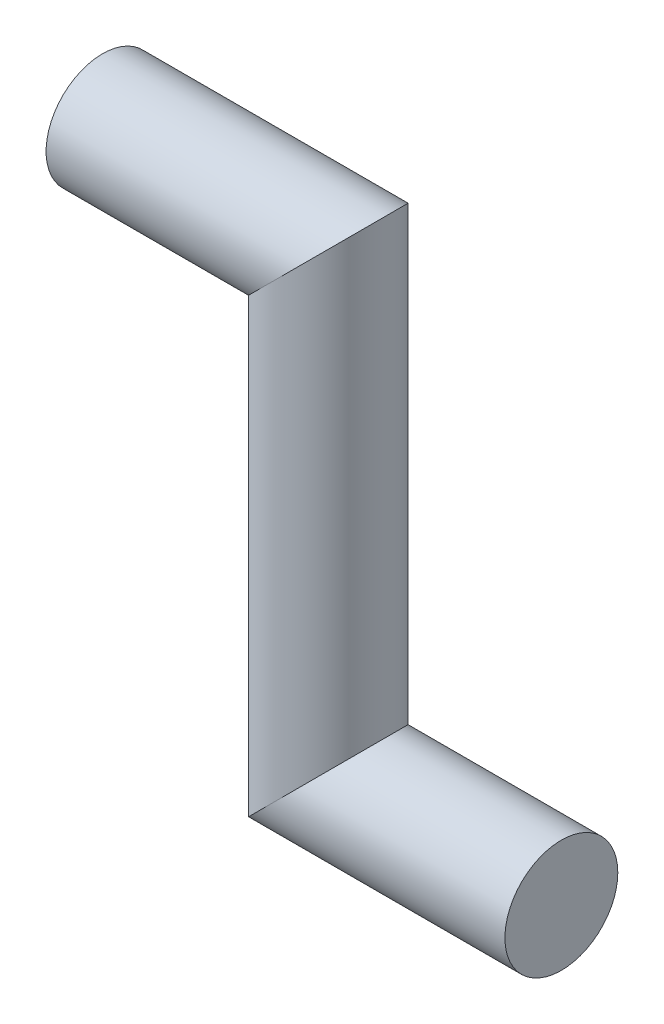
from build123d import *

# Parameters (mm, degrees)
SKETCH_1_R = 2.5


with BuildPart() as part:
    # 扫描1: sweep along a path in 草图2
    with BuildLine(Plane.XY) as sweep_1_path:
        Line((0, 0), (10, 0))
        Line((10, 0), (10, -20))
        Line((10, -20), (20.32, -20))
    # 草图1 → 扫描1 (sweep)
    with BuildSketch(Plane(origin=(0, 0, 0), x_dir=(0, 0, -1), z_dir=(1, 0, 0))):
        Circle(SKETCH_1_R)
    sweep(path=sweep_1_path.line, transition=Transition.RIGHT)


solid = part.part
